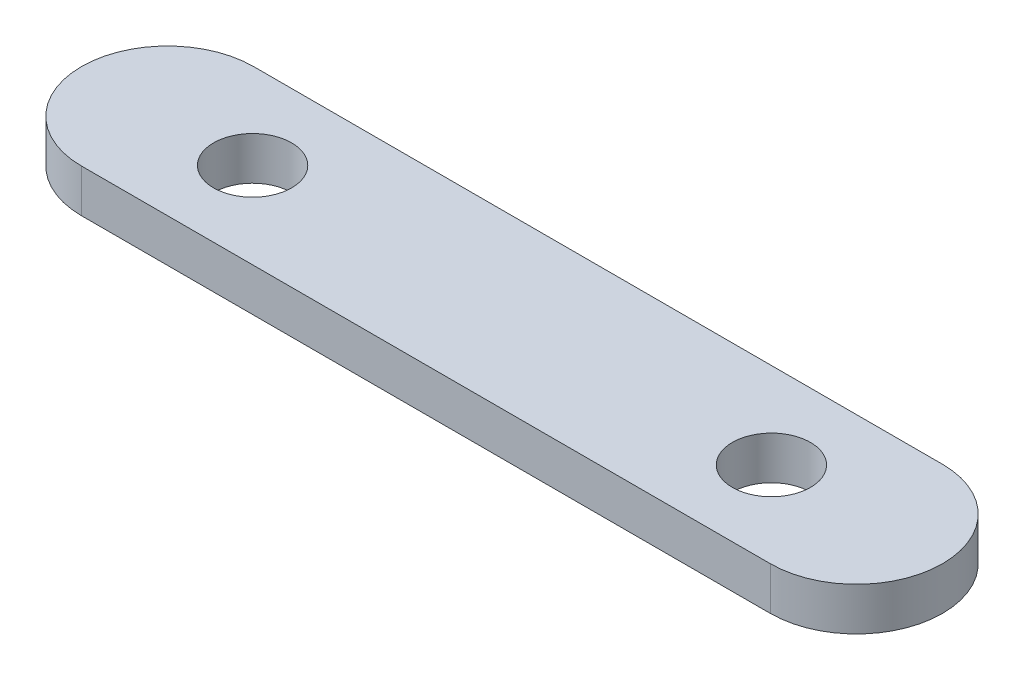
from build123d import *

# Parameters (mm, degrees)
SKETCH_1_R      = 9.067083206
EXTRUDE_1_DEPTH = 10


with BuildPart() as part:
    # 草图1 → 凸台-拉伸1 (new body)
    with BuildSketch(Plane(origin=(0, 0, 0), x_dir=(1, 0, 0), z_dir=(0, 1, 0))):
        with BuildLine():
            Line((-80, 20), (80, 20))
            ThreePointArc((80, 20), (100, 0), (80, -20))
            Line((80, -20), (-80, -20))
            ThreePointArc((-80, -20), (-100, 0), (-80, 20))
        make_face()
        with Locations(Location((-60.25, 0, 0), (0, 0, 270))):
            Circle(SKETCH_1_R, mode=Mode.SUBTRACT)
        with Locations(Location((60.25, 0, 0), (0, 0, 270))):
            Circle(SKETCH_1_R, mode=Mode.SUBTRACT)
    extrude(amount=EXTRUDE_1_DEPTH)


solid = part.part
